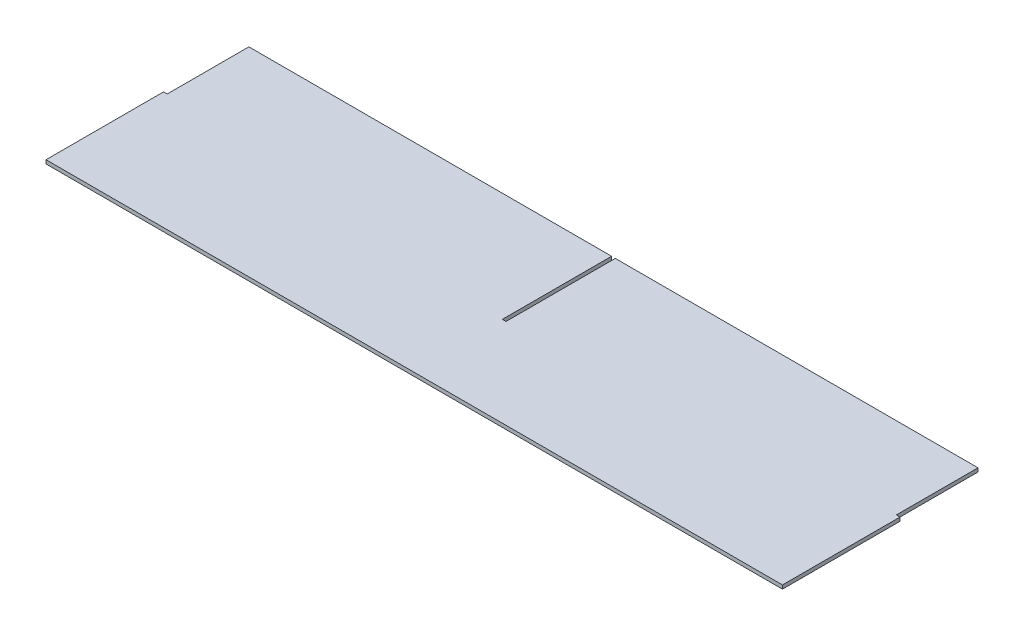
from build123d import *

# Parameters (mm, degrees)
SKETCH1_W           = 636.25984
SKETCH1_H           = 172.09262
BOSS_EXTRUDE1_DEPTH = 3.175
SKETCH2_W           = 3.175
SKETCH2_H           = 3.175
CUT_EXTRUDE1_DEPTH  = 94.36608
SKETCH3_W           = 3.175
SKETCH3_H           = 3.175
CUT_EXTRUDE5_DEPTH  = 70.49262


with BuildPart() as part:
    # Sketch1 → Boss-Extrude1 (new body)
    with BuildSketch(Plane(origin=(0, 0, 0), x_dir=(1, 0, 0), z_dir=(0, 1, 0))):
        with Locations((318.12992, 86.04631)):
            Rectangle(SKETCH1_W, SKETCH1_H)
    extrude(amount=BOSS_EXTRUDE1_DEPTH)

    # Sketch2 → Cut-Extrude1 (cut)
    with BuildSketch(Plane(origin=(0, 0, -172.09262), x_dir=(-1, 0, 0), z_dir=(0, 0, -1))):
        with Locations((-318.12992, 1.5875)):
            Rectangle(SKETCH2_W, SKETCH2_H)
    extrude(amount=-CUT_EXTRUDE1_DEPTH, mode=Mode.SUBTRACT)

    # Sketch3 → Cut-Extrude5 (cut)
    with BuildSketch(Plane.XY.offset(-172.09262)):
        with Locations((1.5875, 1.5875)):
            Rectangle(SKETCH3_W, SKETCH3_H)
        with Locations((634.67234, 1.5875)):
            Rectangle(SKETCH3_W, SKETCH3_H)
    extrude(amount=CUT_EXTRUDE5_DEPTH, mode=Mode.SUBTRACT)


solid = part.part
